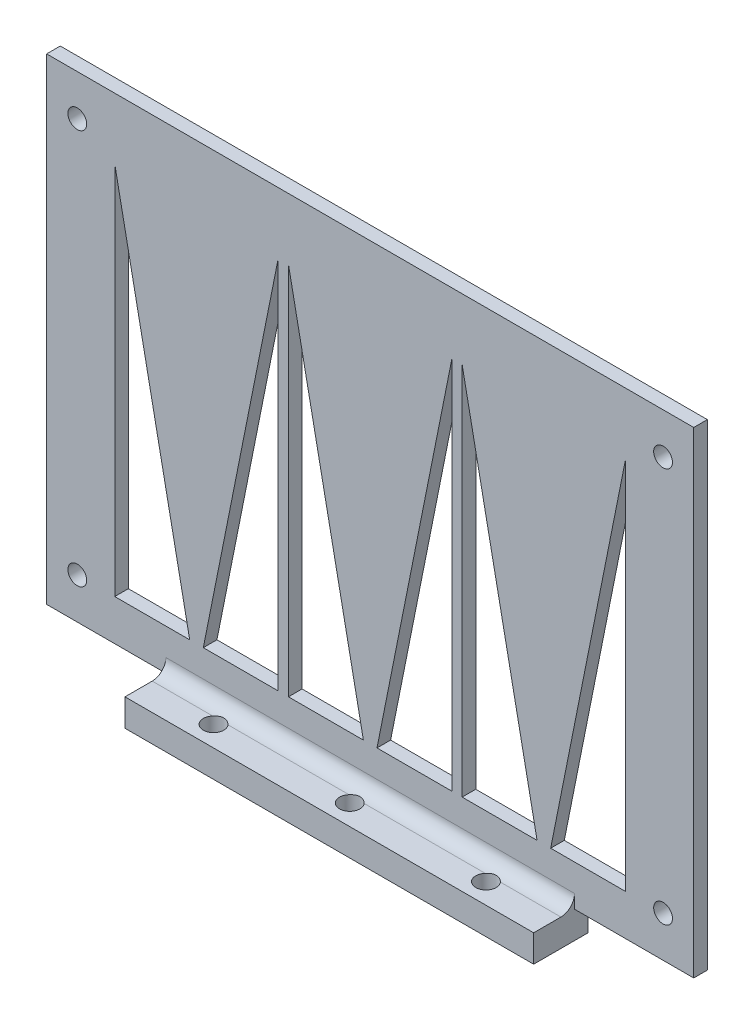
from build123d import *

# Parameters (mm, degrees)
SKETCH1_W             = 60
SKETCH1_H             = 8
BOSS_EXTRUDE1_DEPTH   = 4
SKETCH3_W             = 95
SKETCH3_H             = 70
SKETCH3_R             = 1.38
BOSS_EXTRUDE2_DEPTH   = 2
FILLET3_R             = 2
F_3_0MM_DOWEL_HOLE2_D = 3


with BuildPart() as part:
    # Sketch1 → Boss-Extrude1 (new body)
    with BuildSketch(Plane(origin=(0, 0, 0), x_dir=(1, 0, 0), z_dir=(0, 1, 0))):
        with Locations((30, 4)):
            Rectangle(SKETCH1_W, SKETCH1_H)
    extrude(amount=BOSS_EXTRUDE1_DEPTH)

    # Sketch3 → Boss-Extrude2 (add)
    with BuildSketch(Plane(origin=(0, 0, -8), x_dir=(-1, 0, 0), z_dir=(0, 0, -1))):
        with Locations((-30, 39)):
            Rectangle(SKETCH3_W, SKETCH3_H)
        with Locations((13, 68)):
            Circle(SKETCH3_R, mode=Mode.SUBTRACT)
        with Locations((-73, 68)):
            Circle(SKETCH3_R, mode=Mode.SUBTRACT)
        with Locations((-73, 10)):
            Circle(SKETCH3_R, mode=Mode.SUBTRACT)
        with Locations((13, 10)):
            Circle(SKETCH3_R, mode=Mode.SUBTRACT)
        Polygon((-3.5, 10), (7.5, 65), (7.5, 10), align=None, mode=Mode.SUBTRACT)
        Polygon((-16.5, 10), (-5.5, 10), (-16.5, 65), align=None, mode=Mode.SUBTRACT)
        Polygon((-18, 10), (-29, 10), (-18, 65), align=None, mode=Mode.SUBTRACT)
        Polygon((-42, 10), (-31, 10), (-42, 65), align=None, mode=Mode.SUBTRACT)
        Polygon((-43.5, 10), (-54.5, 10), (-43.5, 65), align=None, mode=Mode.SUBTRACT)
        Polygon((-67.5, 10), (-56.5, 10), (-67.5, 65), align=None, mode=Mode.SUBTRACT)
    extrude(amount=-BOSS_EXTRUDE2_DEPTH)

    # Fillet3
    fillet3_edges = [part.edges().sort_by_distance(p)[0] for p in [
        (30, 4, -6),
    ]]
    fillet(fillet3_edges, radius=FILLET3_R)

    # Ø3.0mm Dowel Hole2 (through all)
    with Locations(Plane(origin=(0, 74, 0), x_dir=(1, 0, 0), z_dir=(0, 1, 0))):
        with Locations((10, 3), (30, 3), (50, 3)):
            Hole(F_3_0MM_DOWEL_HOLE2_D / 2)


solid = part.part
